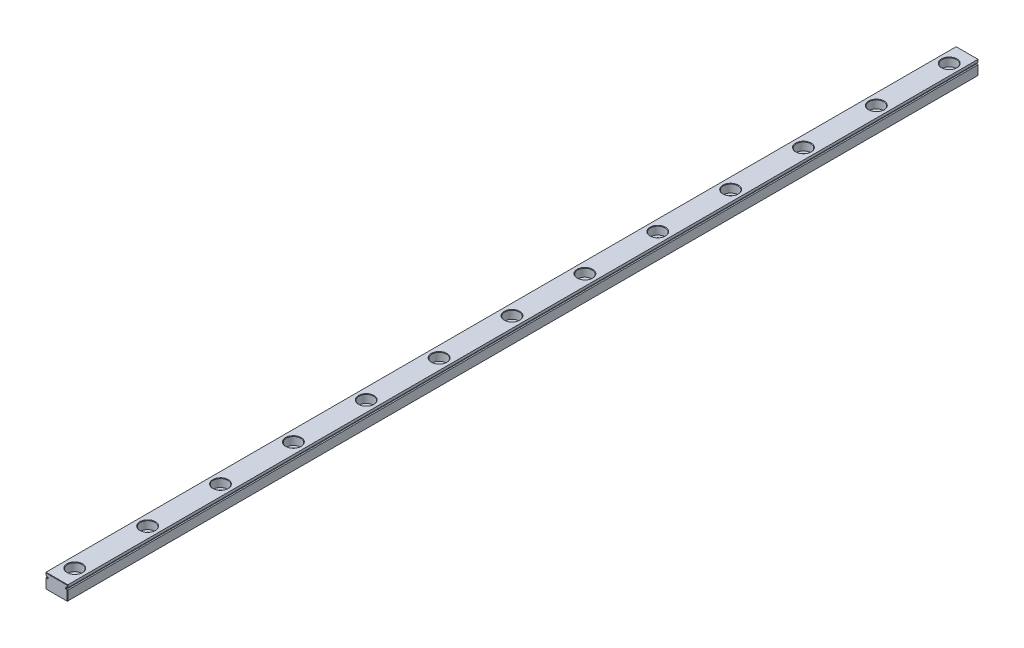
from build123d import *

# Parameters (mm, degrees)
BOSS_EXTRUDE1_DEPTH = 500
CHAMFER1_SIZE       = 0.2
LPATTERN1_COUNT     = 13
LPATTERN1_PITCH     = 40


with BuildPart() as part:
    # Sketch1 → Boss-Extrude1 (new body)
    with BuildSketch(Plane.XY):
        with BuildLine():
            Line((12.21524152, 8.978261926), (12.21524152, 7.53727892))
            ThreePointArc((12.21524152, 7.53727892), (11.921348894, 7.453790184), (11.71524152, 7.228261926))
            Line((11.71524152, 7.228261926), (11.21524152, 7.228261926))
            Line((11.21524152, 7.228261926), (11.21524152, 6.728261926))
            Line((11.21524152, 6.728261926), (11.71524152, 6.728261926))
            ThreePointArc((11.71524152, 6.728261926), (11.921348894, 6.502733668), (12.21524152, 6.419244931))
            Line((12.21524152, 6.419244931), (12.21524152, 1.278261926))
            Line((12.21524152, 1.278261926), (11.91524152, 0.978261926))
            Line((11.91524152, 0.978261926), (0.51524152, 0.978261926))
            Line((0.51524152, 0.978261926), (0.21524152, 1.278261926))
            Line((0.21524152, 1.278261926), (0.21524152, 6.419244931))
            ThreePointArc((0.21524152, 6.419244931), (0.509134147, 6.502733668), (0.71524152, 6.728261926))
            Line((0.71524152, 6.728261926), (1.21524152, 6.728261926))
            Line((1.21524152, 6.728261926), (1.21524152, 7.228261926))
            Line((1.21524152, 7.228261926), (0.71524152, 7.228261926))
            ThreePointArc((0.71524152, 7.228261926), (0.509134147, 7.453790184), (0.21524152, 7.53727892))
            Line((0.21524152, 7.53727892), (0.21524152, 8.978261926))
            Line((0.21524152, 8.978261926), (12.21524152, 8.978261926))
        make_face()
    extrude(amount=-BOSS_EXTRUDE1_DEPTH)

    # Chamfer1
    chamfer1_edges = [part.edges().sort_by_distance(p)[0] for p in [
        (0.509134147, 7.453790184, -500),
        (0.96524152, 7.228261926, -500),
        (12.21524152, 8.257770423, 0),
        (1.21524152, 6.978261926, -500),
        (11.921348894, 7.453790184, 0),
        (11.46524152, 7.228261926, 0),
        (11.21524152, 6.978261926, 0),
        (11.46524152, 6.728261926, 0),
        (11.921348894, 6.502733668, 0),
        (12.21524152, 3.848753429, 0),
        (12.06524152, 1.128261926, 0),
        (6.21524152, 0.978261926, 0),
        (0.96524152, 6.728261926, -500),
        (0.36524152, 1.128261926, 0),
        (0.21524152, 3.848753429, 0),
        (0.509134147, 6.502733668, 0),
        (0.96524152, 6.728261926, 0),
        (1.21524152, 6.978261926, 0),
        (0.96524152, 7.228261926, 0),
        (0.509134147, 7.453790184, 0),
        (0.509134147, 6.502733668, -500),
        (0.21524152, 8.257770423, 0),
        (6.21524152, 8.978261926, 0),
        (0.21524152, 3.848753429, -500),
        (0.36524152, 1.128261926, -500),
        (6.21524152, 0.978261926, -500),
        (12.06524152, 1.128261926, -500),
        (12.21524152, 3.848753429, -500),
        (6.21524152, 8.978261926, -500),
        (11.921348894, 6.502733668, -500),
        (11.46524152, 6.728261926, -500),
        (11.21524152, 6.978261926, -500),
        (11.46524152, 7.228261926, -500),
        (11.921348894, 7.453790184, -500),
        (12.21524152, 8.257770423, -500),
        (0.21524152, 8.257770423, -500),
    ]]
    chamfer(chamfer1_edges, length=CHAMFER1_SIZE)

    # Sketch3 → CBORE for M4 Hex Head Machine Screw1 (revolve, cut)
    with BuildSketch(Plane(origin=(6.21524152, 8.978261926, -10), x_dir=(0, 0, 1), z_dir=(1, 0, 0))):
        Polygon((0, 0), (0, 8), (2.25, 8), (2.25, 4.5), (4, 4.5), (4, 0.25), (4.25, 0), align=None)
    cbore_for_m4_hex_head_machine_screw1 = revolve(axis=Axis((6.21524152, 15.328261926, -10), (0, -1, 0)), mode=Mode.SUBTRACT)

    # LPattern1: CBORE for M4 Hex Head Machine Screw1 ×13
    with Locations(*[(0, 0, -i * LPATTERN1_PITCH) for i in range(1, LPATTERN1_COUNT)]):
        add(cbore_for_m4_hex_head_machine_screw1, mode=Mode.SUBTRACT)


solid = part.part
